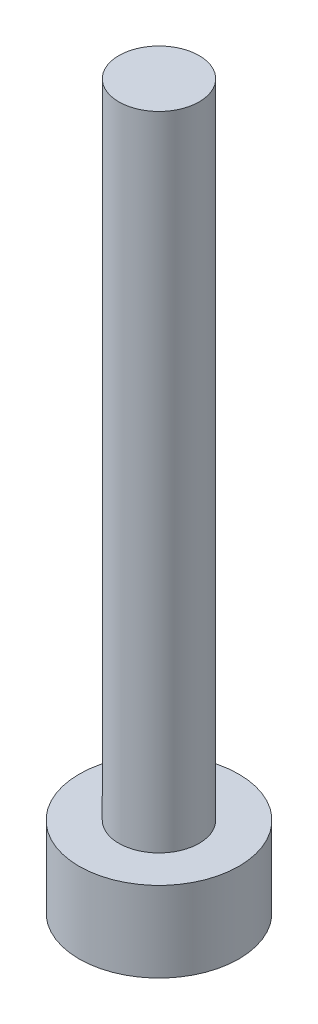
from build123d import *

# Parameters (mm, degrees)
SKETCH_1_R      = 1
EXTRUDE_1_DEPTH = 16
SKETCH_2_R      = 1.99
EXTRUDE_2_DEPTH = 2


with BuildPart() as part:
    # 草图1 → 凸台-拉伸1 (new body)
    with BuildSketch(Plane(origin=(0, 0, 0), x_dir=(1, 0, 0), z_dir=(0, 1, 0))):
        with Locations(Location((0, 0, 0), (0, 0, 270))):
            Circle(SKETCH_1_R)
    extrude(amount=EXTRUDE_1_DEPTH)

    # 草图2 → 凸台-拉伸2 (add)
    with BuildSketch(Plane.XZ):
        with Locations(Location((0, 0, 0), (0, 0, 270))):
            Circle(SKETCH_2_R)
    extrude(amount=EXTRUDE_2_DEPTH)


solid = part.part
